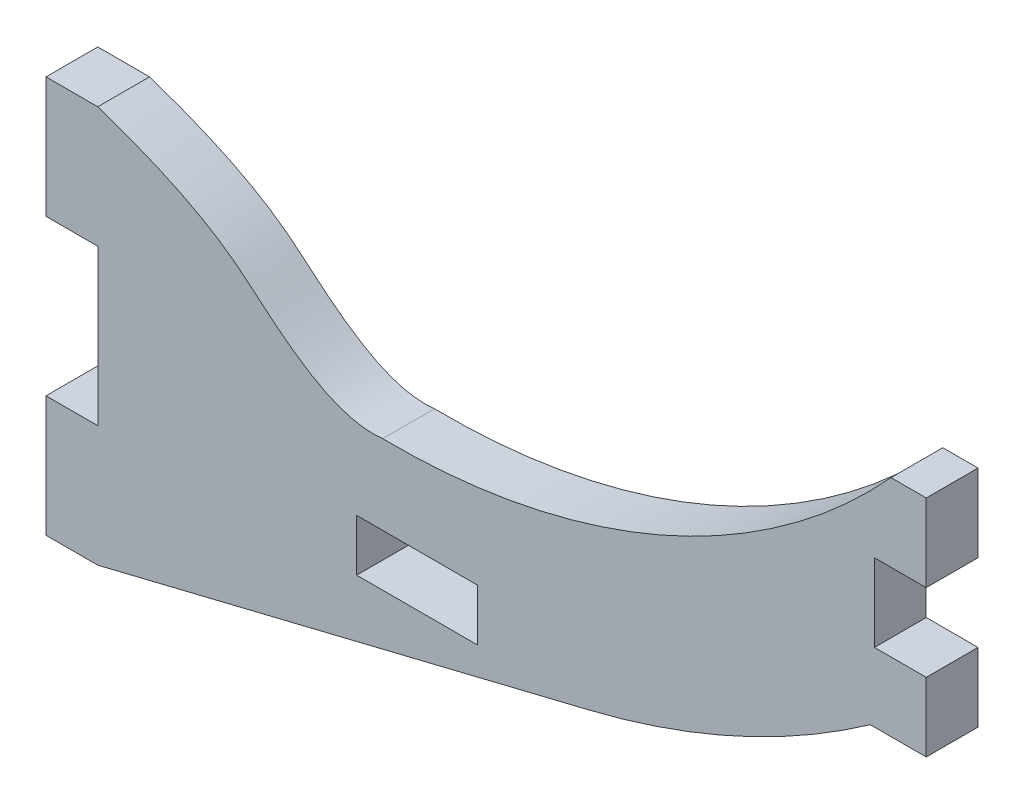
from build123d import *

# Parameters (mm, degrees)
CROQUIS2_W              = 3
CROQUIS2_H              = 7
SALIENTE_EXTRUIR1_DEPTH = 3
CROQUIS3_W              = 7
CROQUIS3_H              = 3
CORTAR_EXTRUIR1_DEPTH   = 3
SALIENTE_EXTRUIR2_DEPTH = 3


with BuildPart() as part:
    # Croquis2 → Saliente-Extruir1 (new body)
    with BuildSketch(Plane.XY):
        with BuildLine():
            ThreePointArc((28.504213464, 6.97614846), (38.823203621, 10.80038439), (48, 16.874324342))
            Line((48, 16.874324342), (48, 18.374324342))
            Line((48, 18.374324342), (45, 18.374324342))
            Line((45, 18.374324342), (45, 22.874324342))
            Line((45, 22.874324342), (48, 22.874324342))
            Line((48, 22.874324342), (48, 27.374324342))
            Line((48, 27.374324342), (45.958765785, 27.374324342))
            ThreePointArc((45.958765785, 27.374324342), (32.608459646, 17.819059857), (16.508760518, 14.604492799))
            add(Edge.make_bspline(
                [(0, 23.003403927), (3.768895236, 21.748521109), (6.947387732, 20.10306336), (11.1476301, 16.408164217), (14.028002641, 14.311208734), (16.508760518, 14.604492799)],
                knots=[0, 0, 0, 0, 0.366175843, 0.466175843, 1, 1, 1, 1], degree=3))
            Line((0, 23.003403927), (0, 16.003403927))
            Line((0, 16.003403927), (0, 7))
            Line((0, 7), (0, 0))
            Line((0, 0), (28.504213464, 6.97614846))
        make_face()
        with Locations((-1.5, 3.5)):
            Rectangle(CROQUIS2_W, CROQUIS2_H)
        with Locations((-1.5, 19.503403927)):
            Rectangle(CROQUIS2_W, CROQUIS2_H)
    extrude(amount=SALIENTE_EXTRUIR1_DEPTH)

    # Croquis3 → Cortar-Extruir1 (cut)
    with BuildSketch(Plane.XY):
        with Locations((18.5, 8.5)):
            Rectangle(CROQUIS3_W, CROQUIS3_H)
    extrude(amount=CORTAR_EXTRUIR1_DEPTH, mode=Mode.SUBTRACT)

    # Croquis4 → Saliente-Extruir2 (add)
    with BuildSketch(Plane.XY):
        with BuildLine():
            Line((45, 18.374324342), (45, 14.546008954))
            ThreePointArc((45, 14.546008954), (44.879211841, 14.45997986), (44.758158478, 14.374324342))
            Line((44.758158478, 14.374324342), (48, 14.374324342))
            Line((48, 14.374324342), (48, 18.374324342))
            Line((48, 18.374324342), (45, 18.374324342))
        make_face()
    extrude(amount=SALIENTE_EXTRUIR2_DEPTH)


solid = part.part
